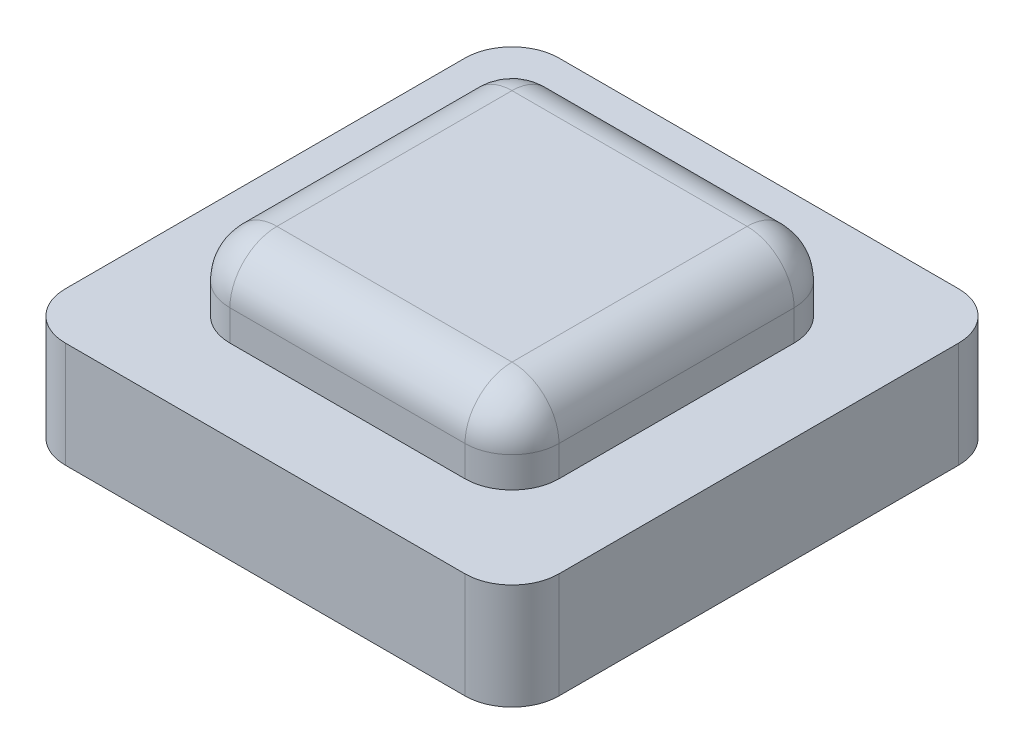
from build123d import *

# Parameters (mm, degrees)
SKETCH1_W           = 21
SKETCH1_H           = 21
BOSS_EXTRUDE1_DEPTH = 4.5
SKETCH2_W           = 9.5
SKETCH2_H           = 9.5
BOSS_EXTRUDE2_DEPTH = 3.5
SKETCH3_W           = 14
SKETCH3_H           = 14
BOSS_EXTRUDE3_DEPTH = 3.3
FILLET1_R           = 2
FILLET2_R           = 2
FILLET3_R           = 2


with BuildPart() as part:
    # Sketch1 → Boss-Extrude1 (new body)
    with BuildSketch(Plane(origin=(0, 0, 0), x_dir=(1, 0, 0), z_dir=(0, 1, 0))):
        Rectangle(SKETCH1_W, SKETCH1_H)
    extrude(amount=BOSS_EXTRUDE1_DEPTH)

    # Sketch2 → Boss-Extrude2 (add)
    with BuildSketch(Plane.XZ):
        Rectangle(SKETCH2_W, SKETCH2_H)
    extrude(amount=BOSS_EXTRUDE2_DEPTH)

    # Sketch3 → Boss-Extrude3 (add)
    with BuildSketch(Plane(origin=(0, 4.5, 0), x_dir=(1, 0, 0), z_dir=(0, 1, 0))):
        Rectangle(SKETCH3_W, SKETCH3_H)
    extrude(amount=BOSS_EXTRUDE3_DEPTH)

    # Fillet1
    fillet1_edges = [part.edges().sort_by_distance(p)[0] for p in [
        (10.5, 2.25, 10.5),
        (-10.5, 2.25, 10.5),
        (-10.5, 2.25, -10.5),
        (10.5, 2.25, -10.5),
    ]]
    fillet(fillet1_edges, radius=FILLET1_R)

    # Fillet2
    fillet2_edges = [part.edges().sort_by_distance(p)[0] for p in [
        (7, 6.15, 7),
        (7, 6.15, -7),
        (-7, 6.15, -7),
        (-7, 6.15, 7),
        (7, 7.8, 0),
        (0, 7.8, -7),
        (-7, 7.8, 0),
        (0, 7.8, 7),
    ]]
    fillet(fillet2_edges, radius=FILLET2_R)

    # Fillet3
    fillet3_edges = [part.edges().sort_by_distance(p)[0] for p in [
        (4.75, -1.75, -4.75),
        (4.75, -1.75, 4.75),
        (-4.75, -1.75, 4.75),
        (-4.75, -1.75, -4.75),
        (4.75, -3.5, 0),
        (0, -3.5, 4.75),
        (-4.75, -3.5, 0),
        (0, -3.5, -4.75),
    ]]
    fillet(fillet3_edges, radius=FILLET3_R)


solid = part.part
